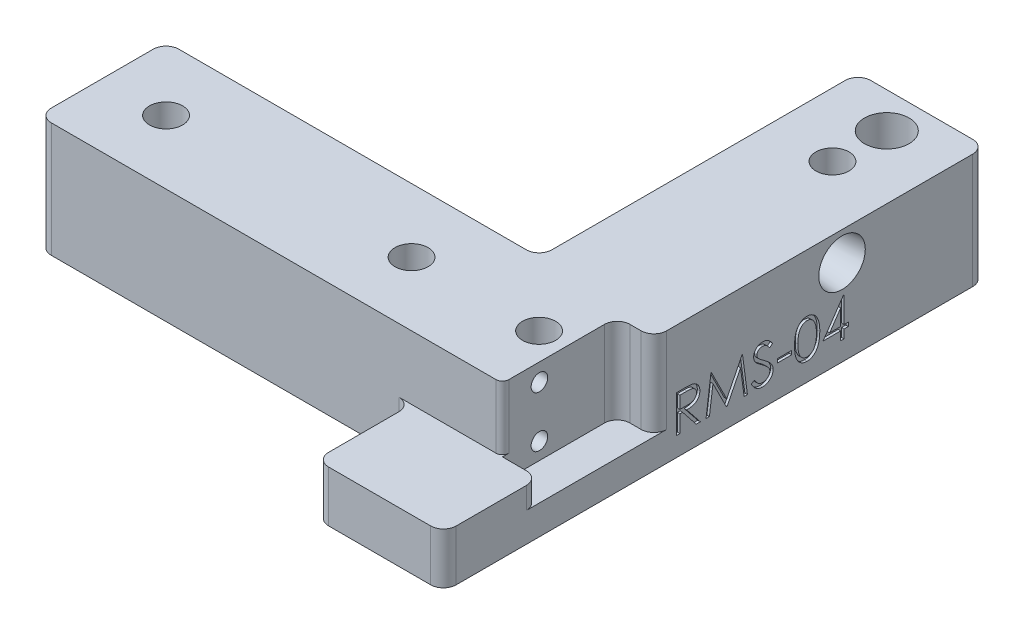
from build123d import *

# Parameters (mm, degrees)
SKETCH1_R                       = 2.6
BOSS_EXTRUDE1_DEPTH             = 10
SKETCH4_R                       = 2.6
MOTOR_TENSIONING_HOLE_DEPTH     = 106.651549918
SKETCH10_W                      = 20
SKETCH10_H                      = 15
BOSS_EXTRUDE3_DEPTH             = 10
FILLET1_R                       = 2
CHAMFER2_SIZE                   = 12
CHAMFER2_SIZE2                  = 1.049863962
SKETCH6_R                       = 3.5
CUT_EXTRUDE1_DEPTH              = 5
SKETCH2_R                       = 2.6
HEIGHT_BUMP_DEPTH               = 8
SKETCH12_W                      = 18
SKETCH12_H                      = 13.4
CUT_EXTRUDE5_DEPTH              = 5.75
SKETCH8_W                       = 2.238782051
SKETCH8_H                       = 0.597008547
RIGHT_SIDE_PART_NUM_SHORT_DEPTH = 0.4
SKETCH11_W                      = 22.169940191
SKETCH11_H                      = 15
CUT_EXTRUDE4_DEPTH              = 10
FILLET2_R                       = 2
SKETCH13_R                      = 1.3
CUT_EXTRUDE6_DEPTH              = 6
FILLET3_R                       = 1


with BuildPart() as part:
    # Sketch1 → Boss-Extrude1 (new body)
    with BuildSketch(Plane(origin=(0, 0, 0), x_dir=(1, 0, 0), z_dir=(0, 1, 0))):
        Polygon((0, 0), (78.5, 0), (78.5, 20), (20, 20), (20, 70), (0, 70), align=None)
        with Locations(Location((10, 56, 0), (0, 0, 270))):
            Circle(SKETCH1_R, mode=Mode.SUBTRACT)
        with Locations(Location((68.5, 10, 0), (0, 0, 270))):
            Circle(SKETCH1_R, mode=Mode.SUBTRACT)
        with Locations(Location((10, 10, 0), (0, 0, 270))):
            Circle(SKETCH1_R, mode=Mode.SUBTRACT)
        with Locations(Location((30, 10, 0), (0, 0, 270))):
            Circle(SKETCH1_R, mode=Mode.SUBTRACT)
    extrude(amount=BOSS_EXTRUDE1_DEPTH)

    # Sketch4 → motor tensioning hole (cut, through all)
    with BuildSketch(Plane.ZY):
        with Locations((-47.5, 5.5)):
            Circle(SKETCH4_R)
    extrude(amount=-MOTOR_TENSIONING_HOLE_DEPTH, mode=Mode.SUBTRACT)

    # Sketch10 → Boss-Extrude3 (add)
    with BuildSketch(Plane(origin=(0, 10, 0), x_dir=(1, 0, 0), z_dir=(0, 1, 0))):
        with Locations((10, -7.5)):
            Rectangle(SKETCH10_W, SKETCH10_H)
    extrude(amount=-BOSS_EXTRUDE3_DEPTH)

    # Fillet1
    fillet1_edges = [part.edges().sort_by_distance(p)[0] for p in [
        (0, 5, -70),
        (20, 5, -70),
        (20, 5, -20),
        (78.5, 5, -20),
        (78.5, 5, 0),
        (0, 5, 15),
        (20, 5, 0),
        (20, 5, 15),
    ]]
    fillet(fillet1_edges, radius=FILLET1_R)

    # Chamfer2
    chamfer2_edges = [part.edges().sort_by_distance(p)[0] for p in [
        (0, 5.5, -50.1),
    ]]
    chamfer2_side = [part.faces().sort_by_distance(p)[0] for p in [
        (10, 5.5, -50.1),
    ]]
    chamfer(chamfer2_edges, length=CHAMFER2_SIZE, length2=CHAMFER2_SIZE2, reference=chamfer2_side[0])

    # Sketch6 → Cut-Extrude1 (cut)
    with BuildSketch(Plane(origin=(0, 10, 0), x_dir=(1, 0, 0), z_dir=(0, 1, 0))):
        with Locations(Location((9.89945477, 64.41665231, 0), (0, 0, 270))):
            Circle(SKETCH6_R)
    extrude(amount=-CUT_EXTRUDE1_DEPTH, mode=Mode.SUBTRACT)


with BuildPart() as body_2:
    # Mirror1: mirrored copy
    add(part.part.mirror(Plane(origin=(78.5, 10, 0), x_dir=(0, 0, 1), z_dir=(-1, 0, 0))))

    # Sketch2 → height bump (add)
    with BuildSketch(Plane(origin=(0, 0, 0), x_dir=(1, 0, 0), z_dir=(0, 1, 0))):
        with BuildLine():
            Line((157, -13), (157, 68))
            ThreePointArc((157, 68), (156.414213562, 69.414213562), (155, 70))
            Line((155, 70), (139, 70))
            ThreePointArc((139, 70), (137.585786438, 69.414213562), (137, 68))
            Line((137, 68), (137, 22))
            ThreePointArc((137, 22), (136.414213562, 20.585786438), (135, 20))
            Line((135, 20), (80.5, 20))
            ThreePointArc((80.5, 20), (79.085786438, 19.414213562), (78.5, 18))
            Line((78.5, 18), (78.5, 2))
            ThreePointArc((78.5, 2), (79.085786438, 0.585786438), (80.5, 0))
            Line((80.5, 0), (135, 0))
            ThreePointArc((135, 0), (136.414213562, -0.585786438), (137, -2))
            Line((137, -2), (137, -13))
            ThreePointArc((137, -13), (137.585786438, -14.414213562), (139, -15))
            Line((139, -15), (155, -15))
            ThreePointArc((155, -15), (156.414213562, -14.414213562), (157, -13))
        make_face()
        with Locations(Location((147, 56, 0), (0, 0, 270))):
            Circle(SKETCH2_R, mode=Mode.SUBTRACT)
        with Locations(Location((147, 10, 0), (0, 0, 270))):
            Circle(SKETCH2_R, mode=Mode.SUBTRACT)
        with Locations(Location((88.5, 10, 0), (0, 0, 270))):
            Circle(SKETCH2_R, mode=Mode.SUBTRACT)
        with Locations(Location((127, 10, 0), (0, 0, 270))):
            Circle(SKETCH2_R, mode=Mode.SUBTRACT)
    extrude(amount=-HEIGHT_BUMP_DEPTH)

    # Sketch12 → Cut-Extrude5 (cut)
    with BuildSketch(Plane(origin=(157, 0, 0), x_dir=(0, 0, -1), z_dir=(1, 0, 0))):
        with Locations((9, 3.3)):
            Rectangle(SKETCH12_W, SKETCH12_H)
    extrude(amount=-CUT_EXTRUDE5_DEPTH, mode=Mode.SUBTRACT)

    # Sketch8 → Right Side Part Num Short (cut)
    # profile 1 of 6: a face of its own
    with BuildSketch(Plane(origin=(157, 0, 0), x_dir=(0, 0, -1), z_dir=(1, 0, 0))):
        with BuildLine():
            Line((21.552144353, 0.820833333), (22.717010639, 0.820833333))
            add(Edge.make_bspline(
                [(22.717010639, 0.820833333), (22.794745587, 0.820574579), (22.944005299, 0.820077742), (23.157834892, 0.81730742), (23.352129481, 0.809367211), (23.526787476, 0.802534246), (23.681805672, 0.790074434), (23.817659416, 0.778165596), (23.933723004, 0.762576305), (24.003981878, 0.748098358), (24.035793191, 0.741543136)],
                knots=[0, 0, 0, 0, 1.410062039, 2.707475311, 3.878576406, 4.937260626, 5.877586885, 6.699081471, 7.410979367, 8, 8, 8, 8], degree=3))
            add(Edge.make_bspline(
                [(24.035793191, 0.741543136), (24.078379446, 0.731021122), (24.162643475, 0.710201559), (24.283966382, 0.666196723), (24.399575323, 0.615273371), (24.508990067, 0.555462279), (24.611662567, 0.486319461), (24.708651472, 0.409038547), (24.800396891, 0.324042397), (24.883188484, 0.229188024), (24.961252597, 0.129674209), (25.027092253, 0.022065699), (25.083847839, -0.090461865), (25.129034996, -0.209052892), (25.16542015, -0.332557291), (25.191075455, -0.462093778), (25.206461061, -0.597072209), (25.208027457, -0.689137684), (25.208821703, -0.735819812)],
                knots=[0, 0, 0, 0, 1.027469482, 2.033020251, 3.019912614, 3.986113645, 4.951240523, 5.91722682, 6.890402269, 7.87763091, 8.8651537, 9.85103654, 10.82876324, 11.815024772, 12.821070561, 13.842952187, 14.906261191, 16, 16, 16, 16], degree=3))
            add(Edge.make_bspline(
                [(25.208821703, -0.735819812), (25.206378619, -0.813378432), (25.20161153, -0.964715389), (25.157165138, -1.184345212), (25.084360616, -1.389220774), (24.984037241, -1.579084114), (24.856279137, -1.750234318), (24.702734217, -1.900562254), (24.523316822, -2.026358632), (24.356293305, -2.113592642), (24.208753142, -2.169460848), (24.087291787, -2.208770364), (23.954798017, -2.239141752), (23.812541283, -2.266350209), (23.659929584, -2.286892253), (23.497328697, -2.301937601), (23.324622657, -2.311340823), (23.205978991, -2.312741157), (23.1449445, -2.313461538)],
                knots=[0, 0, 0, 0, 1.260483769, 2.459530307, 3.627416485, 4.787058657, 5.939039949, 7.08810263, 8.267026773, 9.491475466, 10.141966685, 10.831826277, 11.566392101, 12.351337768, 13.187381173, 14.07005841, 15.007169909, 16, 16, 16, 16], degree=3))
            Line((23.1449445, -2.313461538), (25.283447772, -5))
            Line((25.283447772, -5), (24.637465867, -5))
            Line((24.637465867, -5), (22.498962595, -2.313461538))
            Line((22.498962595, -2.313461538), (22.074526831, -2.313461538))
            Line((22.074526831, -2.313461538), (22.074526831, -5))
            Line((22.074526831, -5), (21.552144353, -5))
            Line((21.552144353, -5), (21.552144353, 0.820833333))
        make_face()
        with BuildLine():
            Line((22.074526831, 0.223824786), (22.074526831, -1.716452991))
            Line((22.074526831, -1.716452991), (23.14028037, -1.724615218))
            add(Edge.make_bspline(
                [(23.14028037, -1.724615218), (23.190040245, -1.724637231), (23.286489053, -1.724679901), (23.42602385, -1.71803787), (23.555945035, -1.710481899), (23.675755667, -1.698924476), (23.785509268, -1.684029676), (23.88515098, -1.665398046), (23.974843456, -1.643691223), (24.079449716, -1.610093995), (24.196259756, -1.556864938), (24.323206244, -1.479422079), (24.431311322, -1.382016056), (24.522644957, -1.27063282), (24.596036405, -1.148168725), (24.647778714, -1.01609174), (24.680612276, -0.87773619), (24.684484869, -0.782643551), (24.686439225, -0.734653779)],
                knots=[0, 0, 0, 0, 1.146690395, 2.22261258, 3.21895312, 4.145990853, 4.996080663, 5.770904154, 6.481378293, 7.121626537, 8.300444488, 9.431385265, 10.535395872, 11.636531494, 12.74115979, 13.810798291, 14.895190096, 16, 16, 16, 16], degree=3))
            add(Edge.make_bspline(
                [(24.686439225, -0.734653779), (24.684439983, -0.687843347), (24.680478215, -0.59508215), (24.648133061, -0.459280594), (24.593434887, -0.331110916), (24.519722784, -0.211094505), (24.429917047, -0.102152228), (24.324613494, -0.008940474), (24.206691402, 0.06797679), (24.096476087, 0.11712854), (23.99796395, 0.147263581), (23.912431528, 0.168469981), (23.815786606, 0.185507509), (23.707559921, 0.199158296), (23.588213494, 0.21089134), (23.457143876, 0.218794), (23.315220683, 0.223473724), (23.216853703, 0.223705042), (23.165933081, 0.223824786)],
                knots=[0, 0, 0, 0, 1.101028733, 2.181837193, 3.264309656, 4.369019818, 5.486613113, 6.575447106, 7.666700264, 8.788928104, 9.402425223, 10.0903467, 10.862060571, 11.710948788, 12.657782767, 13.684531032, 14.801375019, 16, 16, 16, 16], degree=3))
            Line((23.165933081, 0.223824786), (22.074526831, 0.223824786))
        make_face(mode=Mode.SUBTRACT)
    # profile 2 of 6: a face of its own
    with BuildSketch(Plane(origin=(157, 0, 0), x_dir=(0, 0, -1), z_dir=(1, 0, 0))):
        Polygon((26.178960592, -5), (26.94737589, 0.820833333), (27.022001958, 0.820833333), (29.425194566, -3.955235043), (31.822557013, 0.820833333), (31.898349114, 0.820833333), (32.671428541, -5), (32.146713998, -5), (31.589350549, -0.811611912), (29.488160312, -5), (29.370391048, -5), (27.261038584, -0.802283654), (26.704841168, -5), align=None)
    # profile 3 of 6: a face of its own
    with BuildSketch(Plane(origin=(157, 0, 0), x_dir=(0, 0, -1), z_dir=(1, 0, 0))):
        with BuildLine():
            Line((33.268437088, -3.877110877), (33.760502726, -3.582104701))
            add(Edge.make_bspline(
                [(33.760502726, -3.582104701), (33.806268176, -3.65871416), (33.89395301, -3.805494928), (34.040224497, -4.003832407), (34.191787208, -4.172407327), (34.349763516, -4.310239018), (34.513189146, -4.418754131), (34.683130959, -4.495592843), (34.859016271, -4.543516554), (34.978715591, -4.549337531), (35.038474147, -4.55224359)],
                knots=[0, 0, 0, 0, 1.272034388, 2.437168799, 3.508375237, 4.49857839, 5.41946034, 6.295179144, 7.148887113, 8, 8, 8, 8], degree=3))
            add(Edge.make_bspline(
                [(35.038474147, -4.55224359), (35.089509319, -4.550822188), (35.190686666, -4.548004256), (35.339637206, -4.520927731), (35.484296227, -4.479330179), (35.621682259, -4.419756558), (35.749899609, -4.347680529), (35.862335982, -4.26062385), (35.959537434, -4.163156149), (36.039048545, -4.054418567), (36.100050937, -3.937474452), (36.146937032, -3.817438971), (36.172956279, -3.692426483), (36.176875785, -3.608256463), (36.178853755, -3.565780248)],
                knots=[0, 0, 0, 0, 1.095163259, 2.171163733, 3.241058638, 4.321873601, 5.38011039, 6.391990106, 7.366004449, 8.327778327, 9.272591725, 10.192022065, 11.087607919, 12, 12, 12, 12], degree=3))
            add(Edge.make_bspline(
                [(36.178853755, -3.565780248), (36.176401835, -3.51731624), (36.171417442, -3.418795993), (36.129288778, -3.273442046), (36.063015686, -3.129596665), (36.001875908, -3.040618965), (35.97013397, -2.994424412)],
                knots=[0, 0, 0, 0, 0.938893495, 1.908633276, 2.914225137, 4, 4, 4, 4], degree=3))
            add(Edge.make_bspline(
                [(35.97013397, -2.994424412), (35.944072246, -2.961084636), (35.889358917, -2.891091944), (35.795298387, -2.786906952), (35.684925218, -2.679440367), (35.562016568, -2.564588578), (35.422095228, -2.447693278), (35.269543636, -2.323180201), (35.100466956, -2.195784483), (34.981889103, -2.110347014), (34.920704883, -2.066262687)],
                knots=[0, 0, 0, 0, 0.722233717, 1.516239348, 2.393582979, 3.351407094, 4.387010283, 5.505090956, 6.712668013, 8, 8, 8, 8], degree=3))
            add(Edge.make_bspline(
                [(34.920704883, -2.066262687), (34.85946307, -2.022642048), (34.742373388, -1.939242707), (34.578627388, -1.815468035), (34.432201061, -1.7023046), (34.303745221, -1.598687094), (34.193316367, -1.504601464), (34.100044314, -1.420951201), (34.02630507, -1.345474017), (33.985300492, -1.296510262), (33.966890447, -1.274526743)],
                knots=[0, 0, 0, 0, 1.452282411, 2.77665338, 3.964542531, 5.026858415, 5.96415736, 6.766646006, 7.446254459, 8, 8, 8, 8], degree=3))
            add(Edge.make_bspline(
                [(33.966890447, -1.274526743), (33.94115813, -1.240265256), (33.890552077, -1.172885446), (33.823752184, -1.067570176), (33.766975505, -0.959762912), (33.722467198, -0.849173956), (33.68498732, -0.737355866), (33.659778238, -0.622849688), (33.643993141, -0.506169223), (33.642376634, -0.427648675), (33.64156743, -0.388342181)],
                knots=[0, 0, 0, 0, 1.068054152, 2.10047183, 3.106115577, 4.101338837, 5.06977816, 6.043150881, 7.020423561, 8, 8, 8, 8], degree=3))
            add(Edge.make_bspline(
                [(33.64156743, -0.388342181), (33.643738117, -0.326758139), (33.648033093, -0.204906371), (33.684355954, -0.026903907), (33.741687659, 0.143041837), (33.822006657, 0.303248356), (33.925546564, 0.44954416), (34.045365881, 0.583612067), (34.188078555, 0.696317673), (34.344663335, 0.794792965), (34.516055896, 0.871870653), (34.695655053, 0.930014093), (34.883746255, 0.962958775), (35.011144564, 0.967686563), (35.075787181, 0.97008547)],
                knots=[0, 0, 0, 0, 1.005424448, 1.989358655, 2.955360095, 3.929531133, 4.905563448, 5.876582895, 6.856512386, 7.866279853, 8.892233794, 9.918561126, 10.94386622, 12, 12, 12, 12], degree=3))
            add(Edge.make_bspline(
                [(35.075787181, 0.97008547), (35.144380048, 0.967719631), (35.280789368, 0.963014733), (35.481440504, 0.922106696), (35.674626838, 0.854417602), (35.830031887, 0.777601465), (35.951658634, 0.700880527), (36.044414, 0.630997558), (36.138407903, 0.550545145), (36.234398526, 0.459308994), (36.33075936, 0.356451957), (36.428920983, 0.242678466), (36.529112939, 0.118683813), (36.593567626, 0.030166399), (36.626610165, -0.015211839)],
                knots=[0, 0, 0, 0, 1.286793592, 2.559021753, 3.825965368, 5.121522368, 5.803751409, 6.523245864, 7.299691795, 8.125521123, 9.008227632, 9.944561021, 10.946284179, 12, 12, 12, 12], degree=3))
            Line((36.626610165, -0.015211839), (36.154367076, -0.373183761))
            add(Edge.make_bspline(
                [(36.154367076, -0.373183761), (36.125851757, -0.336448165), (36.070937921, -0.265703996), (35.98756781, -0.166631225), (35.908988808, -0.076131437), (35.83157106, 0.002474972), (35.759403318, 0.073492687), (35.689358666, 0.134295044), (35.622445108, 0.185477791), (35.538098055, 0.240099759), (35.432129421, 0.294244325), (35.29910752, 0.340061065), (35.160095584, 0.36759371), (35.065416185, 0.371234039), (35.017485565, 0.373076923)],
                knots=[0, 0, 0, 0, 1.181633172, 2.275549214, 3.290209073, 4.226197932, 5.078386478, 5.862611352, 6.581680152, 7.217281963, 8.414376989, 9.595101626, 10.782541182, 12, 12, 12, 12], degree=3))
            add(Edge.make_bspline(
                [(35.017485565, 0.373076923), (34.957353825, 0.371061751), (34.841395429, 0.36717568), (34.676765238, 0.324733514), (34.528593556, 0.257907254), (34.401279349, 0.164250082), (34.295278686, 0.053286717), (34.218600918, -0.074403831), (34.172449751, -0.215405041), (34.166818045, -0.313763249), (34.163949908, -0.363855502)],
                knots=[0, 0, 0, 0, 1.14458467, 2.207223713, 3.21896685, 4.227309161, 5.202851033, 6.127160689, 7.046193047, 8, 8, 8, 8], degree=3))
            add(Edge.make_bspline(
                [(34.163949908, -0.363855502), (34.164603715, -0.395040997), (34.165912399, -0.457462981), (34.184164532, -0.549683976), (34.207613059, -0.641672002), (34.244770984, -0.733013488), (34.296069661, -0.825305892), (34.363433626, -0.920138472), (34.448273623, -1.018347088), (34.513262416, -1.082222208), (34.547574541, -1.115946347)],
                knots=[0, 0, 0, 0, 0.858281714, 1.717966888, 2.583508476, 3.4729293, 4.427298488, 5.488583878, 6.674047936, 8, 8, 8, 8], degree=3))
            add(Edge.make_bspline(
                [(34.547574541, -1.115946347), (34.560316133, -1.127316973), (34.590587239, -1.154330975), (34.645928273, -1.19855647), (34.719009331, -1.253110605), (34.807922063, -1.320611177), (34.914305878, -1.398912133), (35.038172473, -1.487012295), (35.178141118, -1.587771683), (35.277464352, -1.658216307), (35.329982227, -1.69546441)],
                knots=[0, 0, 0, 0, 0.420754252, 0.999615792, 1.744751191, 2.668019286, 3.750313428, 4.999500688, 6.413464383, 8, 8, 8, 8], degree=3))
            add(Edge.make_bspline(
                [(35.329982227, -1.69546441), (35.393156418, -1.741434623), (35.515484484, -1.83044957), (35.689540007, -1.964188505), (35.847357448, -2.094987234), (35.989490894, -2.222010469), (36.117344515, -2.34429469), (36.229499867, -2.463311075), (36.327099742, -2.578206961), (36.4321728, -2.72551159), (36.539538602, -2.906424894), (36.631743109, -3.128079297), (36.68988217, -3.350595321), (36.697485036, -3.500152214), (36.701236233, -3.573942475)],
                knots=[0, 0, 0, 0, 1.163667725, 2.253281268, 3.268753668, 4.215851969, 5.092017293, 5.902905408, 6.650798638, 7.335211899, 8.59617414, 9.77448103, 10.901945474, 12, 12, 12, 12], degree=3))
            add(Edge.make_bspline(
                [(36.701236233, -3.573942475), (36.70014335, -3.626127684), (36.697978806, -3.729484702), (36.673097382, -3.881250586), (36.636642891, -4.028652163), (36.581698825, -4.16986743), (36.514637572, -4.307479851), (36.429543229, -4.437879656), (36.330908901, -4.563952917), (36.217762271, -4.682337842), (36.093951645, -4.79101479), (35.963093167, -4.887688955), (35.824972654, -4.968296393), (35.680339386, -5.03407321), (35.529160143, -5.085518596), (35.371485769, -5.122793332), (35.207056356, -5.145670389), (35.095295555, -5.148044892), (35.038474147, -5.149252137)],
                knots=[0, 0, 0, 0, 0.983748083, 1.948392443, 2.894712957, 3.844097841, 4.80183111, 5.778335162, 6.776009319, 7.81870978, 8.863265674, 9.881300176, 10.883814829, 11.87499822, 12.874611388, 13.892143829, 14.928324115, 16, 16, 16, 16], degree=3))
            add(Edge.make_bspline(
                [(35.038474147, -5.149252137), (34.994509654, -5.148401993), (34.907134356, -5.146712412), (34.777896086, -5.131775688), (34.651268698, -5.110642564), (34.528841136, -5.077091165), (34.40903606, -5.036383621), (34.292374528, -4.986260703), (34.178800002, -4.926194357), (34.067675998, -4.857516799), (33.959285138, -4.777592192), (33.854644071, -4.684502937), (33.750319461, -4.580816425), (33.649390541, -4.463716952), (33.5498158, -4.335096355), (33.453558493, -4.193751248), (33.35862616, -4.04045153), (33.299061626, -3.932574715), (33.268437088, -3.877110877)],
                knots=[0, 0, 0, 0, 0.915332311, 1.819136955, 2.706846663, 3.586547465, 4.459518054, 5.340707479, 6.227863349, 7.133153174, 8.059268498, 9.028702269, 10.047606654, 11.120612155, 12.245963614, 13.433783089, 14.680604001, 16, 16, 16, 16], degree=3))
        make_face()
    # profile 4 of 6: a face of its own
    with BuildSketch(Plane(origin=(157, 0, 0), x_dir=(0, 0, -1), z_dir=(1, 0, 0))):
        with Locations((38.492261875, -2.761217949)):
            Rectangle(SKETCH8_W, SKETCH8_H)
    # profile 5 of 6: a face of its own
    with BuildSketch(Plane(origin=(157, 0, 0), x_dir=(0, 0, -1), z_dir=(1, 0, 0))):
        with BuildLine():
            add(Edge.make_bspline(
                [(40.05940931, -2.091915398), (40.059954836, -1.9986201), (40.061014527, -1.817392638), (40.072803246, -1.553318656), (40.092386761, -1.305583508), (40.119224749, -1.074175338), (40.151884581, -0.859034403), (40.195483432, -0.660735646), (40.245064962, -0.478361277), (40.30252897, -0.311316584), (40.367369376, -0.157351047), (40.437941593, -0.013617706), (40.517046376, 0.11966596), (40.600162742, 0.244627261), (40.690655199, 0.359220668), (40.785948545, 0.465064477), (40.88976207, 0.559712475), (40.998566764, 0.645937813), (41.113347717, 0.721524613), (41.230833198, 0.78810287), (41.351831869, 0.844980507), (41.47667408, 0.889701862), (41.604237739, 0.926640616), (41.734968777, 0.951901282), (41.869083045, 0.967795331), (41.959607705, 0.969314848), (42.005517249, 0.97008547)],
                knots=[0, 0, 0, 0, 1.646270934, 3.197905019, 4.663502075, 6.030701355, 7.308322542, 8.50163776, 9.611534131, 10.641858119, 11.616356847, 12.558055219, 13.465016945, 14.349605745, 15.204443733, 16.039544428, 16.859896111, 17.680448484, 18.487036065, 19.28249412, 20.06191084, 20.843045899, 21.620316918, 22.403196591, 23.190181807, 24, 24, 24, 24], degree=3))
            add(Edge.make_bspline(
                [(42.005517249, 0.97008547), (42.051810301, 0.969274187), (42.143872616, 0.9676608), (42.279980954, 0.952154196), (42.412944889, 0.926424245), (42.542197556, 0.889967576), (42.668800658, 0.844738576), (42.791763946, 0.788048454), (42.911851199, 0.722058718), (43.02715407, 0.64451877), (43.138938377, 0.558067294), (43.244458382, 0.460339379), (43.34372369, 0.35232181), (43.437980121, 0.235170282), (43.524553537, 0.106637826), (43.606998876, -0.031040033), (43.680793797, -0.180271007), (43.751865632, -0.33856519), (43.813212204, -0.510302489), (43.868537138, -0.694514835), (43.913239423, -0.893378096), (43.950474915, -1.105848899), (43.979321129, -1.332707535), (44.000330416, -1.573467705), (44.011428392, -1.828287807), (44.013518406, -2.002510087), (44.014590934, -2.091915398)],
                knots=[0, 0, 0, 0, 0.810914788, 1.612654377, 2.396697861, 3.181598691, 3.963628158, 4.749916497, 5.551656086, 6.361998678, 7.18212741, 8.025565596, 8.878627764, 9.750805457, 10.657531673, 11.591944965, 12.560506719, 13.57287815, 14.630710178, 15.753379473, 16.941251878, 18.199788006, 19.531962791, 20.947069417, 22.433333509, 24, 24, 24, 24], degree=3))
            add(Edge.make_bspline(
                [(44.014590934, -2.091915398), (44.013507287, -2.180930754), (44.011395845, -2.354373546), (44.000454829, -2.608047085), (43.978903391, -2.847529545), (43.951944637, -3.073395278), (43.914606547, -3.284704199), (43.868696526, -3.482187526), (43.81772212, -3.666698083), (43.754799255, -3.836724312), (43.685929299, -3.99463807), (43.610998217, -4.142099982), (43.530720899, -4.280413447), (43.443260808, -4.40847136), (43.350038643, -4.527180865), (43.249059178, -4.634446554), (43.143168931, -4.732853016), (43.031055663, -4.820417687), (42.913954548, -4.897061106), (42.794279749, -4.965603665), (42.669907861, -5.020872802), (42.543657391, -5.068329292), (42.413722477, -5.10458552), (42.280265087, -5.129654777), (42.143964061, -5.147236768), (42.051825982, -5.148578021), (42.005517249, -5.149252137)],
                knots=[0, 0, 0, 0, 1.561518951, 3.042555995, 4.452378317, 5.7783523, 7.031515105, 8.214008947, 9.334062868, 10.386615937, 11.391082383, 12.354592575, 13.286541444, 14.194233754, 15.072674879, 15.931287219, 16.775624067, 17.606195743, 18.42308326, 19.229000347, 20.022332153, 20.807536673, 21.593273796, 22.3848459, 23.188221202, 24, 24, 24, 24], degree=3))
            add(Edge.make_bspline(
                [(42.005517249, -5.149252137), (41.959608979, -5.148476543), (41.86908683, -5.146947224), (41.734954166, -5.131124983), (41.604763007, -5.105687104), (41.477870912, -5.070069252), (41.353626863, -5.026471482), (41.233723872, -4.969670654), (41.11682876, -4.904254351), (41.003253398, -4.829755299), (40.895131983, -4.744402452), (40.791856088, -4.649998034), (40.696020193, -4.544186242), (40.606821584, -4.428637838), (40.522046821, -4.304415863), (40.444065327, -4.169824271), (40.371935466, -4.025396739), (40.306004566, -3.870200166), (40.247548991, -3.701969887), (40.195913695, -3.518781313), (40.155144317, -3.319017571), (40.120247664, -3.104283092), (40.092100803, -2.873655139), (40.072884859, -2.627008505), (40.061008172, -2.36449689), (40.05995199, -2.184433944), (40.05940931, -2.091915398)],
                knots=[0, 0, 0, 0, 0.810891512, 1.598919785, 2.382837074, 3.152667961, 3.926044502, 4.706494248, 5.493654104, 6.291793342, 7.103789334, 7.925228297, 8.761435821, 9.622817696, 10.50288917, 11.416980706, 12.369136599, 13.353924996, 14.394355917, 15.514179734, 16.714354668, 17.994756427, 19.357759367, 20.818452758, 22.365282078, 24, 24, 24, 24], degree=3))
        make_face()
        with BuildLine():
            add(Edge.make_bspline(
                [(40.581791789, -2.089583333), (40.581990441, -2.167330872), (40.582375985, -2.318223577), (40.592448023, -2.537491477), (40.606168945, -2.742002845), (40.623866435, -2.932017357), (40.650148244, -3.106891842), (40.679596318, -3.267829042), (40.715432844, -3.413977256), (40.757833486, -3.546339365), (40.80612827, -3.667161685), (40.858858141, -3.779588944), (40.915504367, -3.884949248), (40.978900145, -3.982296213), (41.047943649, -4.071947298), (41.121075367, -4.155489282), (41.201024653, -4.229990928), (41.31162671, -4.319343805), (41.457640609, -4.411677412), (41.641612961, -4.492081564), (41.830654421, -4.542610483), (41.958964297, -4.549036277), (42.023007734, -4.55224359)],
                knots=[0, 0, 0, 0, 1.459021318, 2.831673884, 4.118529203, 5.306027144, 6.411944654, 7.436330062, 8.375795394, 9.233974572, 10.042671642, 10.816086306, 11.563610507, 12.285937304, 12.993564865, 13.685989202, 14.367179055, 15.041617293, 16.353048772, 17.594441528, 18.799311195, 20, 20, 20, 20], degree=3))
            add(Edge.make_bspline(
                [(42.023007734, -4.55224359), (42.087465433, -4.549586328), (42.216247751, -4.544277291), (42.404400027, -4.493056058), (42.587058226, -4.415772788), (42.73020406, -4.324389853), (42.839107766, -4.237362858), (42.917135189, -4.163164448), (42.988751477, -4.080083083), (43.056675737, -3.990443421), (43.118973747, -3.892532873), (43.175623989, -3.786822257), (43.227318557, -3.673018017), (43.256770387, -3.593572391), (43.271828347, -3.552953893)],
                knots=[0, 0, 0, 0, 1.353760809, 2.704726607, 4.075137775, 5.516104923, 6.260822281, 7.007110065, 7.778089737, 8.566572457, 9.372053459, 10.217411131, 11.088608312, 12, 12, 12, 12], degree=3))
            add(Edge.make_bspline(
                [(43.271828347, -3.552953893), (43.289376942, -3.501015862), (43.325008115, -3.395559385), (43.370929126, -3.231971264), (43.407093795, -3.060335238), (43.439629536, -2.881677038), (43.461836939, -2.694679107), (43.479711577, -2.499920037), (43.490240112, -2.297252986), (43.491545228, -2.159557031), (43.492208455, -2.089583333)],
                knots=[0, 0, 0, 0, 0.884706709, 1.796334032, 2.740027952, 3.714592787, 4.726048262, 5.777819803, 6.87074269, 8, 8, 8, 8], degree=3))
            add(Edge.make_bspline(
                [(43.492208455, -2.089583333), (43.491293438, -2.019620954), (43.489503469, -1.882759583), (43.482661516, -1.682326371), (43.4649935, -1.491955583), (43.445370441, -1.310827094), (43.416437206, -1.139943555), (43.385241186, -0.977874417), (43.34332917, -0.826627505), (43.298559021, -0.683834844), (43.247318399, -0.551118755), (43.190913303, -0.42786047), (43.130673068, -0.313464922), (43.065243175, -0.208245973), (42.995400355, -0.111732327), (42.919301193, -0.025859078), (42.839964277, 0.05203526), (42.728840934, 0.140948604), (42.583362859, 0.231606746), (42.402342181, 0.315037182), (42.213962312, 0.362948116), (42.086613365, 0.369703089), (42.023007734, 0.373076923)],
                knots=[0, 0, 0, 0, 1.31362396, 2.569729283, 3.763502607, 4.902122613, 5.988968491, 7.01645872, 7.998833611, 8.933434873, 9.825090667, 10.667526885, 11.477055099, 12.250526234, 12.991942729, 13.710640831, 14.402115721, 15.076753259, 16.378508321, 17.609869233, 18.806226677, 20, 20, 20, 20], degree=3))
            add(Edge.make_bspline(
                [(42.023007734, 0.373076923), (41.958628333, 0.369698434), (41.829752246, 0.362935301), (41.639414398, 0.315215687), (41.456965613, 0.232039362), (41.311872237, 0.140648333), (41.200671392, 0.053604736), (41.122368389, -0.021877259), (41.0489491, -0.104443709), (40.981314842, -0.194919274), (40.917968736, -0.292152748), (40.859791981, -0.396909063), (40.80737566, -0.509719082), (40.759005306, -0.63048713), (40.716475324, -0.762837819), (40.681394055, -0.908806015), (40.648985229, -1.069231328), (40.626042383, -1.245052938), (40.60564659, -1.435115043), (40.592539157, -1.640136964), (40.582342292, -1.859772606), (40.581978965, -2.011445492), (40.581791789, -2.089583333)],
                knots=[0, 0, 0, 0, 1.207732386, 2.417664972, 3.655092373, 4.956220595, 5.625982001, 6.301752483, 6.994047911, 7.697131622, 8.419323945, 9.170223765, 9.943494443, 10.752040957, 11.610060368, 12.549350801, 13.567764191, 14.679664412, 15.874934091, 17.154273443, 18.533957287, 20, 20, 20, 20], degree=3))
        make_face(mode=Mode.SUBTRACT)
    # profile 6 of 6: a face of its own
    with BuildSketch(Plane(origin=(157, 0, 0), x_dir=(0, 0, -1), z_dir=(1, 0, 0))):
        Polygon((47.71441148, 0.97008547), (47.820520421, 0.97008547), (47.820520421, -3.059722222), (48.492155037, -3.059722222), (48.492155037, -3.656730769), (47.820520421, -3.656730769), (47.820520421, -5), (47.298137943, -5), (47.298137943, -3.656730769), (44.536973413, -3.656730769), align=None)
        Polygon((47.298137943, -3.059722222), (47.298137943, -0.531764156), (45.563081853, -3.059722222), align=None, mode=Mode.SUBTRACT)
    extrude(amount=-RIGHT_SIDE_PART_NUM_SHORT_DEPTH, mode=Mode.SUBTRACT)

    # Sketch11 → Cut-Extrude4 (cut)
    with BuildSketch(Plane(origin=(0, 10, 0), x_dir=(1, 0, 0), z_dir=(0, 1, 0))):
        with Locations((145.915029904, -7.5)):
            Rectangle(SKETCH11_W, SKETCH11_H)
    extrude(amount=-CUT_EXTRUDE4_DEPTH, mode=Mode.SUBTRACT)

    # Fillet2
    fillet2_edges = [body_2.edges().sort_by_distance(p)[0] for p in [
        (151.25, 3.3, -18),
        (157, 3.3, -18),
        (157, -1.7, 0),
    ]]
    fillet(fillet2_edges, radius=FILLET2_R)

    # Sketch13 → Cut-Extrude6 (cut)
    with BuildSketch(Plane(origin=(151.25, 0, 0), x_dir=(0, 0, -1), z_dir=(1, 0, 0))):
        with Locations((5.8, 7.25)):
            Circle(SKETCH13_R)
        with Locations((5.8, -0.75)):
            Circle(SKETCH13_R)
    extrude(amount=-CUT_EXTRUDE6_DEPTH, mode=Mode.SUBTRACT)

    # Fillet3
    fillet3_edges = [body_2.edges().sort_by_distance(p)[0] for p in [
        (151.25, 5, 0),
    ]]
    fillet(fillet3_edges, radius=FILLET3_R)


solid = body_2.part
